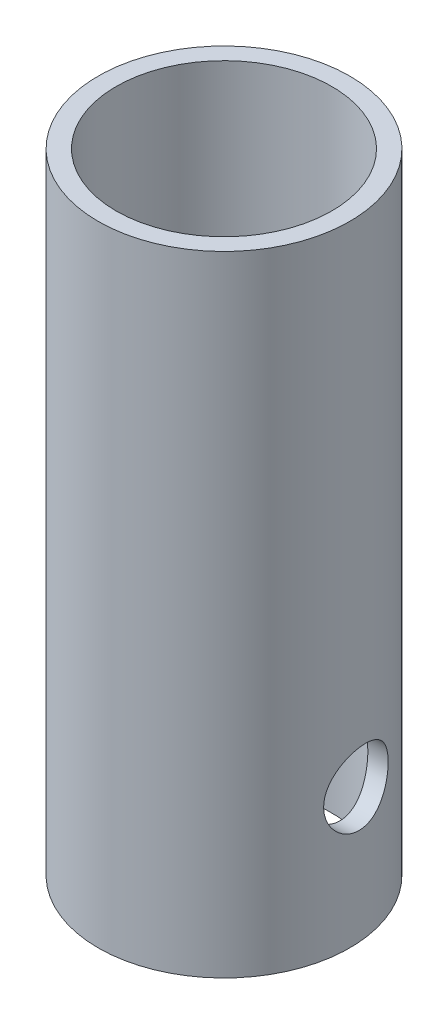
from build123d import *

# Parameters (mm, degrees)
SKETCH_1_R          = 14
SKETCH_1_R_2        = 12
EXTRUDE_1_DEPTH     = 70
SKETCH_4_R          = 4
CUT_EXTRUDE_2_DEPTH = 64


with BuildPart() as part:
    # Эскиз1 → Вытянуть1 (new body)
    with BuildSketch(Plane(origin=(0, 0, 0), x_dir=(1, 0, 0), z_dir=(0, 1, 0))):
        with Locations(Location((0, 0, 0), (0, 0, 270))):
            Circle(SKETCH_1_R)
        with Locations(Location((0, 0, 0), (0, 0, 270))):
            Circle(SKETCH_1_R_2, mode=Mode.SUBTRACT)
    extrude(amount=EXTRUDE_1_DEPTH)

    # Эскиз4 → Вырез-Вытянуть2 (cut)
    with BuildSketch(Plane(origin=(-28.865238988, 0, 1.802113758), x_dir=(0.062310653226350834, 0, 0.9980568032404296), z_dir=(-0.9980568032404296, 0, 0.062310653226350834))):
        with Locations((-0.488081216, 14.748349479)):
            Circle(SKETCH_4_R)
    extrude(amount=-CUT_EXTRUDE_2_DEPTH, mode=Mode.SUBTRACT)


solid = part.part
